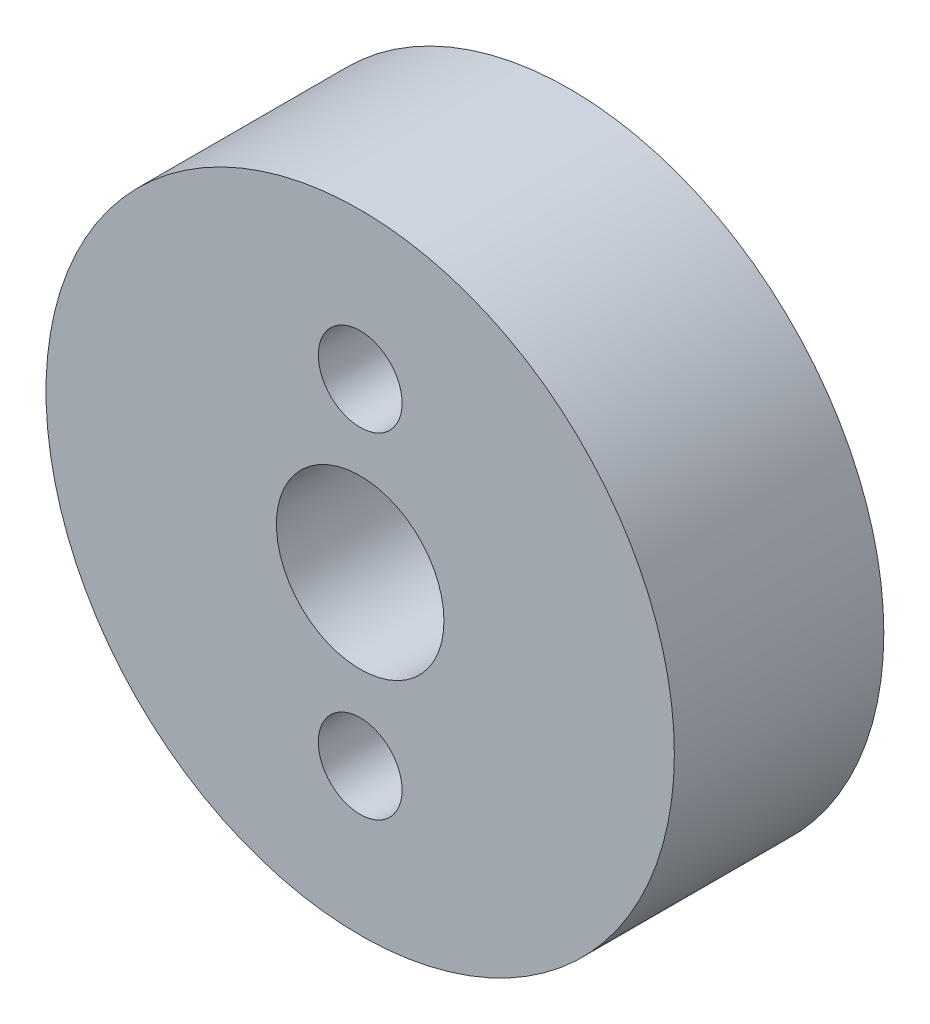
from build123d import *

# Parameters (mm, degrees)
SKETCH_1_R            = 7.5
SKETCH_1_R_2          = 2
EXTRUDE_1_DEPTH       = 5
HOLE_WIZARD_2_0_2_1_D = 2


with BuildPart() as part:
    # 草图1 → 凸台-拉伸1 (new body)
    with BuildSketch(Plane.XY):
        Circle(SKETCH_1_R)
        Circle(SKETCH_1_R_2, mode=Mode.SUBTRACT)
    extrude(amount=EXTRUDE_1_DEPTH)

    # Ø2.0 (2) 直径孔1 (through all)
    with Locations(Plane.XY.offset(5)):
        with Locations((0, -4), (0, 4)):
            Hole(HOLE_WIZARD_2_0_2_1_D / 2)


solid = part.part
